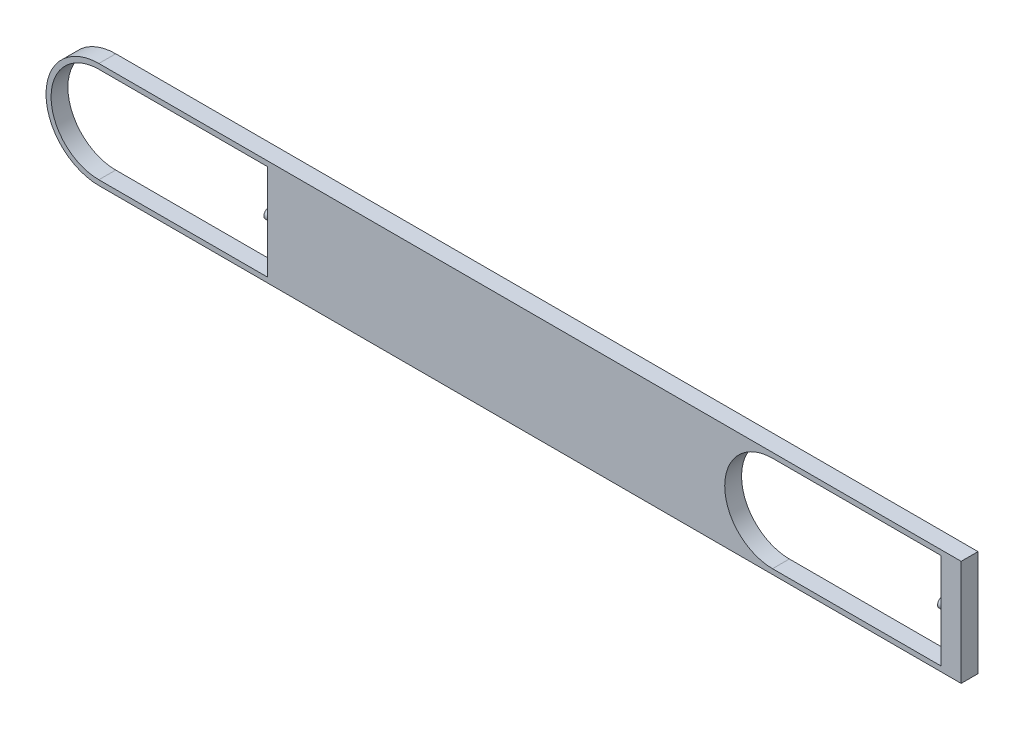
from build123d import *

# Parameters (mm, degrees)
SKETCH1_R                = 19.939
CIRCLE_EXTRUDE_DEPTH     = 6.35
SKETCH3_W                = 6.35
SKETCH3_H                = 39.878
RECTANGLE_EXTRUDE_DEPTH  = 127
SKETCH2_R                = 18.034
CIRCLE_CUT_DEPTH         = 129.712416732
SKETCH6_W                = 125.095
SKETCH6_H                = 36.068
RECTANGLE_CUT_DEPTH      = 129.712416732
SKETCH7_W                = 61.595
SKETCH7_H                = 36.068
END_SHAPE_DEPTH          = 6.35
SKETCH8_R                = 1.905
FOR_SPRING_EXTRUDE_DEPTH = 2.54
MIRRORED_PATTERN_COUNT   = 2
MIRRORED_PATTERN_PITCH   = 254
MIDDLE_CONNECTOR_REACH   = 256.861
SKETCH10_W               = 6.35
SKETCH10_H               = 39.878
SKETCH11_W               = 6.35
SKETCH11_H               = 39.878
END_CUT_DEPTH            = 55.88


with BuildPart() as part:
    # Sketch1 → circle extrude (new body)
    with BuildSketch(Plane.XY):
        Circle(SKETCH1_R)
    extrude(amount=CIRCLE_EXTRUDE_DEPTH)

    # Sketch3 → rectangle extrude (add)
    with BuildSketch(Plane(origin=(0, 0, 0), x_dir=(0, 0, -1), z_dir=(1, 0, 0))):
        with Locations((-3.175, 0)):
            Rectangle(SKETCH3_W, SKETCH3_H)
    extrude(amount=RECTANGLE_EXTRUDE_DEPTH)

    # Sketch2 → circle cut (cut, through all)
    with BuildSketch(Plane.XY.offset(6.35)):
        Circle(SKETCH2_R)
    extrude(amount=-CIRCLE_CUT_DEPTH, mode=Mode.SUBTRACT)

    # Sketch6 → rectangle cut (cut, through all)
    with BuildSketch(Plane.XY.offset(6.35)):
        with Locations((62.5475, 0)):
            Rectangle(SKETCH6_W, SKETCH6_H)
    extrude(amount=-RECTANGLE_CUT_DEPTH, mode=Mode.SUBTRACT)

    # Sketch7 → end shape (add)
    with BuildSketch(Plane.XY.offset(6.35)):
        with Locations((94.2975, 0)):
            Rectangle(SKETCH7_W, SKETCH7_H)
    extrude(amount=-END_SHAPE_DEPTH)

    # Sketch8 → for spring extrude (add)
    with BuildSketch(Plane.ZY.offset(-63.5)):
        with Locations((3.175, 0)):
            Circle(SKETCH8_R)
    extrude(amount=FOR_SPRING_EXTRUDE_DEPTH)


with BuildPart() as mirrored_pattern_1:
    # mirrored pattern: pattern copy
    add(part.part.moved(Location(Vector(1, 0, 0) * (1 * MIRRORED_PATTERN_PITCH))))

    # Sketch10 → middle connector (add, up to next)
    with BuildSketch(Plane(origin=(127, 0, 0), x_dir=(0, 0, -1), z_dir=(1, 0, 0)), mode=Mode.PRIVATE) as middle_connector_sk1:
        with Locations((-3.175, 0)):
            Rectangle(SKETCH10_W, SKETCH10_H)
    middle_connector_tool1 = extrude(middle_connector_sk1.sketch, amount=MIDDLE_CONNECTOR_REACH, mode=Mode.PRIVATE) - mirrored_pattern_1.part

    add(part.part)  # middle connector merges part
    add(middle_connector_tool1.solids().sort_by_distance((127, 0, 3.175))[0])

    # Sketch11 → end cut (cut)
    with BuildSketch(Plane(origin=(381, 0, 0), x_dir=(0, 0, -1), z_dir=(1, 0, 0))):
        with Locations((-3.175, 0)):
            Rectangle(SKETCH11_W, SKETCH11_H)
    extrude(amount=-END_CUT_DEPTH, mode=Mode.SUBTRACT)


solid = mirrored_pattern_1.part
